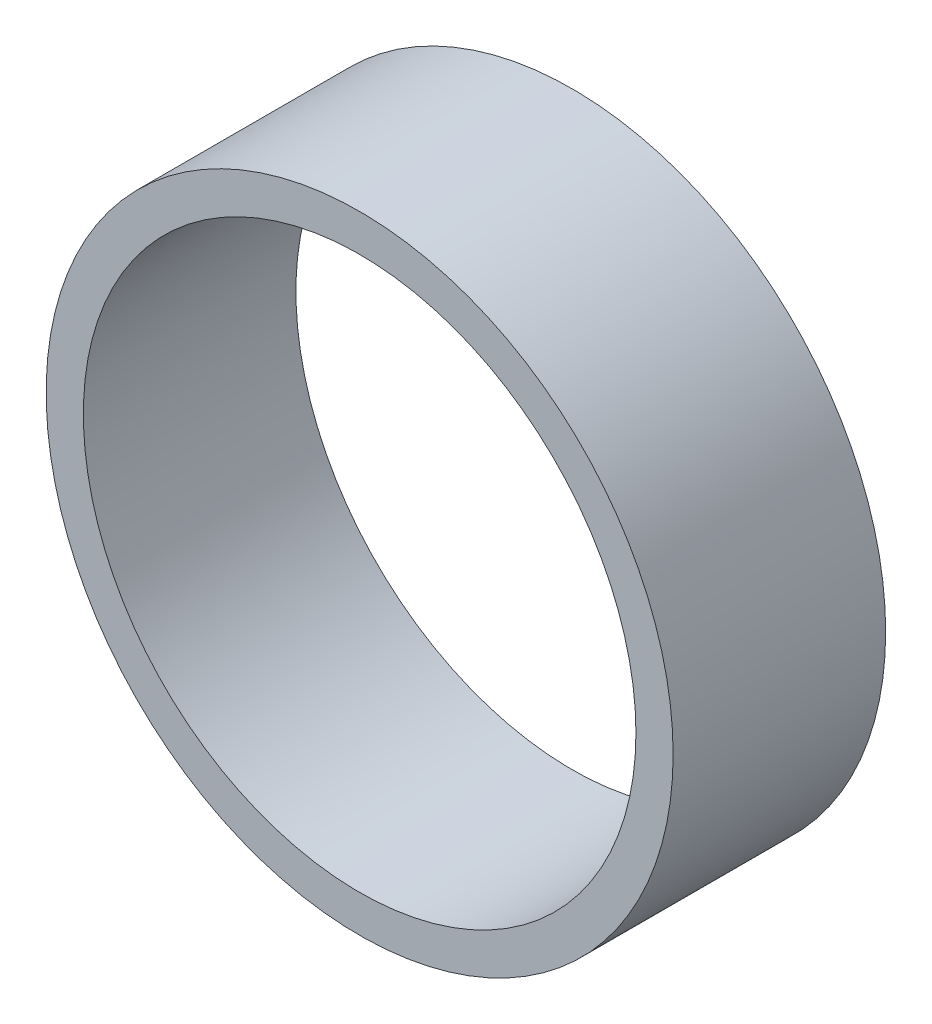
from build123d import *

# Parameters (mm, degrees)
SKETCH_1_R      = 14.75
SKETCH_1_R_2    = 13
EXTRUDE_1_DEPTH = 10


with BuildPart() as part:
    # 草图1 → 凸台-拉伸1 (new body)
    with BuildSketch(Plane.XY):
        Circle(SKETCH_1_R)
        Circle(SKETCH_1_R_2, mode=Mode.SUBTRACT)
    extrude(amount=EXTRUDE_1_DEPTH)


solid = part.part
